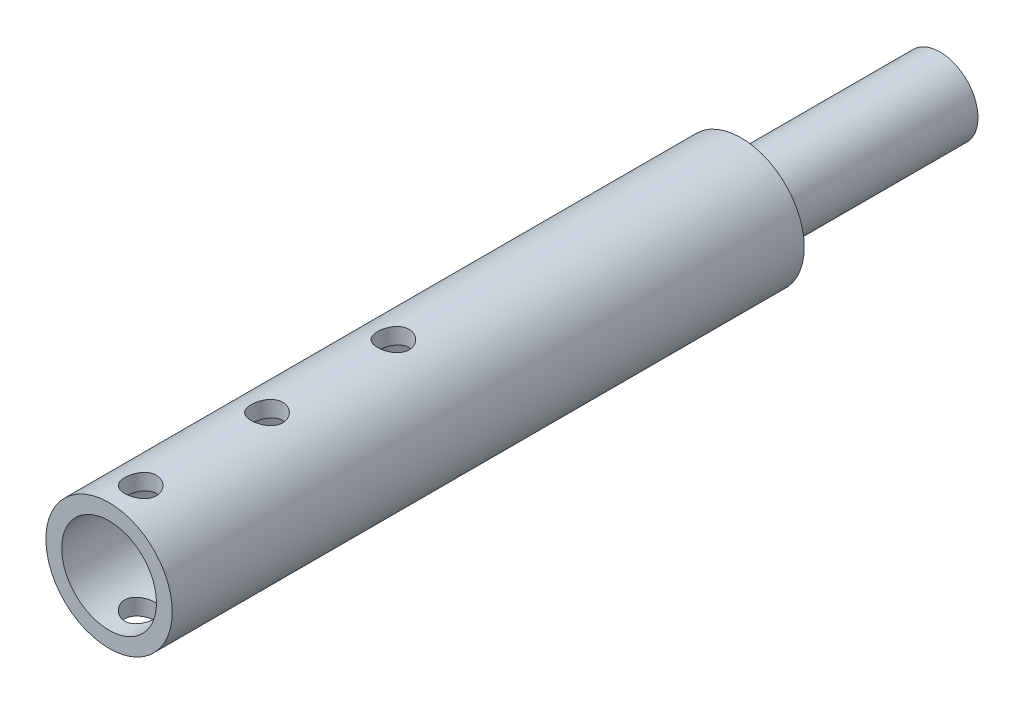
from build123d import *

# Parameters (mm, degrees)
SZKIC1_R                        = 12
SZKIC1_R_2                      = 6
DODANIE_WYCI_GNI_CIE1_DEPTH     = 40
SZKIC2_R                        = 12
DODANIE_WYCI_GNI_CIE2_DEPTH     = 23
SZKIC3_R                        = 20
DODANIE_WYCI_GNI_CIE3_DEPTH     = 200
SZKIC4_R                        = 15
WYTNIJ_WYCI_GNI_CIE1_DEPTH      = 150
WYTNIJ_WYCI_GNI_CIE2_DEPTH      = 250
WYTNIJ_WYCI_GNI_CIE2_DEPTH_BACK = 250
SZKIC5_R                        = 5


with BuildPart() as part:
    # Szkic1 → Dodanie-wyciągnięcie1 (new body)
    with BuildSketch(Plane.XY):
        Circle(SZKIC1_R)
        Circle(SZKIC1_R_2, mode=Mode.SUBTRACT)
    extrude(amount=DODANIE_WYCI_GNI_CIE1_DEPTH)

    # Szkic2 → Dodanie-wyciągnięcie2 (add)
    with BuildSketch(Plane.XY.offset(40)):
        Circle(SZKIC2_R)
    extrude(amount=DODANIE_WYCI_GNI_CIE2_DEPTH)

    # Szkic3 → Dodanie-wyciągnięcie3 (add)
    with BuildSketch(Plane.XY.offset(63)):
        Circle(SZKIC3_R)
    extrude(amount=DODANIE_WYCI_GNI_CIE3_DEPTH)

    # Szkic4 → Wytnij-wyciągnięcie1 (cut)
    with BuildSketch(Plane.XY.offset(263)):
        Circle(SZKIC4_R)
    extrude(amount=-WYTNIJ_WYCI_GNI_CIE1_DEPTH, mode=Mode.SUBTRACT)

    # Szkic5 → Wytnij-wyciągnięcie2 (cut, two sides: drawn at the far end of the back side and taken through both)
    with BuildSketch(Plane(origin=(0, 0, 0), x_dir=(1, 0, 0), z_dir=(0, 1, 0)).offset(-WYTNIJ_WYCI_GNI_CIE2_DEPTH_BACK)):
        with Locations((0, -333.024962479)):
            Circle(SZKIC5_R)
        with Locations((0, -293.024962479)):
            Circle(SZKIC5_R)
        with Locations((0, -253.024962479)):
            Circle(SZKIC5_R)
        with Locations((0, -213.024962479)):
            Circle(SZKIC5_R)
        with Locations((0, -173.024962479)):
            Circle(SZKIC5_R)
    extrude(amount=WYTNIJ_WYCI_GNI_CIE2_DEPTH + WYTNIJ_WYCI_GNI_CIE2_DEPTH_BACK, mode=Mode.SUBTRACT)


solid = part.part
